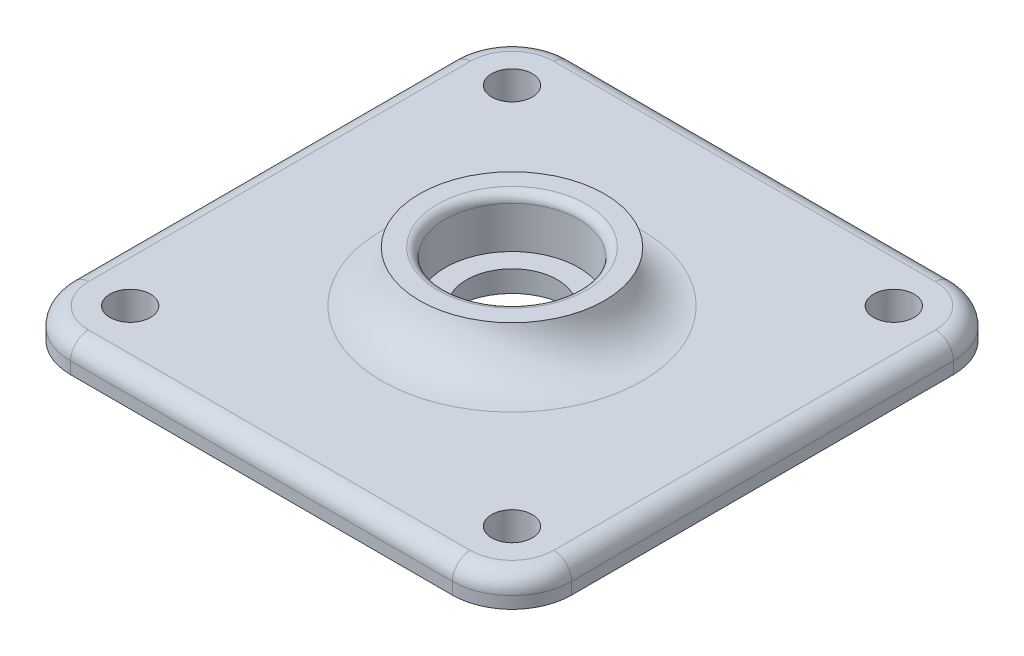
from build123d import *

# Parameters (mm, degrees)
BOSS_EXTRUDE1_DEPTH              = 5
FILLET1_R                        = 3
TAP_DRILL_FOR_M8X1_25_TAP1_D     = 6.8
TAP_DRILL_FOR_M8X1_25_TAP1_DEPTH = 8
TAP_DRILL_FOR_M8X1_25_TAP1_TIP   = 2.042926105


with BuildPart() as part:
    # Sketch1 → Boss-Extrude1 (new body)
    with BuildSketch(Plane(origin=(0, 0, 0), x_dir=(1, 0, 0), z_dir=(0, 1, 0))):
        with BuildLine():
            Line((32, 42), (-32, 42))
            ThreePointArc((-32, 42), (-39.071067812, 39.071067812), (-42, 32))
            Line((-42, 32), (-42, -32))
            ThreePointArc((-42, -32), (-39.071067812, -39.071067812), (-32, -42))
            Line((-32, -42), (32, -42))
            ThreePointArc((32, -42), (39.071067812, -39.071067812), (42, -32))
            Line((42, -32), (42, 32))
            ThreePointArc((42, 32), (39.071067812, 39.071067812), (32, 42))
        make_face()
    extrude(amount=BOSS_EXTRUDE1_DEPTH)

    # Sketch3 → Revolve2 (revolve)
    with BuildSketch(Plane.XY):
        with BuildLine():
            Line((-21.830169384, 5), (-11.15, 5))
            Line((-11.15, 5), (-11.15, 12))
            ThreePointArc((-11.15, 12), (-11.537197996, 13.009021804), (-12.5, 13.5))
            Line((-12.5, 13.5), (-15.5, 13.5))
            ThreePointArc((-15.5, 13.5), (-13.822949017, 13.104101966), (-12.5, 12))
            ThreePointArc((-12.5, 12), (-16.03878275, 6.998773158), (-21.830169384, 5))
        make_face()
    revolve(axis=Axis((0, 0, 0), (0, -1, 0)))

    # Sketch3<5> → Cut-Revolve2 (revolve, cut)
    with BuildSketch(Plane.XY):
        with BuildLine():
            Line((0, 0), (0, 5))
            Line((0, 5), (-7.6, 5))
            ThreePointArc((-7.6, 5), (-8.694616444, 4.701278719), (-9.6, 4.017392631))
            Line((-9.6, 4.017392631), (-9.6, 0))
            Line((-9.6, 0), (0, 0))
        make_face()
    revolve(axis=Axis((0, 0, 0), (0, -1, 0)), mode=Mode.SUBTRACT)

    # Fillet1
    fillet1_edges = [part.edges().sort_by_distance(p)[0] for p in [
        (42, 5, 0),
        (39.071067812, 5, -39.071067812),
        (0, 5, -42),
        (-39.071067812, 5, -39.071067812),
        (-42, 5, 0),
        (-39.071067812, 5, 39.071067812),
        (0, 5, 42),
        (39.071067812, 5, 39.071067812),
    ]]
    fillet(fillet1_edges, radius=FILLET1_R)

    # Tap Drill for M8x1.25 Tap1
    with Locations(Plane(origin=(0, 5, 0), x_dir=(1, 0, 0), z_dir=(0, 1, 0))):
        with Locations((-32, 32), (-32, -32), (32, -32), (32, 32)):
            Hole(TAP_DRILL_FOR_M8X1_25_TAP1_D / 2, depth=TAP_DRILL_FOR_M8X1_25_TAP1_DEPTH)
            with Locations((0, 0, -(TAP_DRILL_FOR_M8X1_25_TAP1_DEPTH + TAP_DRILL_FOR_M8X1_25_TAP1_TIP / 2))):  # 118° drill point
                Cone(0, TAP_DRILL_FOR_M8X1_25_TAP1_D / 2, TAP_DRILL_FOR_M8X1_25_TAP1_TIP, mode=Mode.SUBTRACT)


solid = part.part
